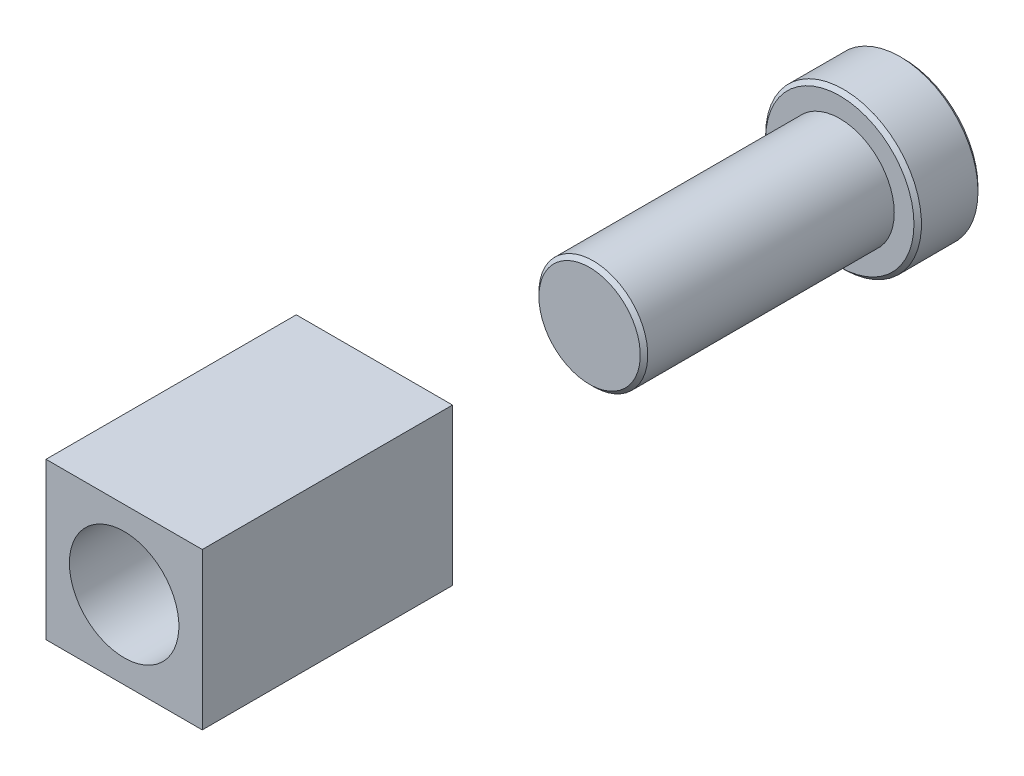
from build123d import *

# Parameters (mm, degrees)
SKETCH1_R           = 15.8115
BOSS_EXTRUDE1_DEPTH = 12.998823529
SKETCH2_R           = 11.049
BOSS_EXTRUDE2_DEPTH = 50.8
SKETCH3_W           = 31.722698392
SKETCH3_H           = 31.722698392
BOSS_EXTRUDE3_DEPTH = 50.8
SKETCH4_R           = 11.1125
CUT_EXTRUDE1_DEPTH  = 110.798996017
CHAMFER1_SIZE       = 0.762


with BuildPart() as part:
    # Sketch1 → Boss-Extrude1 (new body)
    with BuildSketch(Plane.XY):
        with Locations(Location((0, 0, 0), (0, 0, 180))):
            Circle(SKETCH1_R)
    extrude(amount=BOSS_EXTRUDE1_DEPTH)

    # Sketch2 → Boss-Extrude2 (add)
    with BuildSketch(Plane.XY.offset(12.998823529)):
        Circle(SKETCH2_R)
    extrude(amount=BOSS_EXTRUDE2_DEPTH)

    # Chamfer1
    chamfer1_edges = [part.edges().sort_by_distance(p)[0] for p in [
        (15.8115, 0, 0),
        (15.8115, 0, 12.998823529),
        (-11.049, 0, 63.798823529),
    ]]
    chamfer(chamfer1_edges, length=CHAMFER1_SIZE)


with BuildPart() as body_2:
    # Sketch3 → Boss-Extrude3 (new body)
    with BuildSketch(Plane.XY.offset(107.483276511)):
        Rectangle(SKETCH3_W, SKETCH3_H)
    extrude(amount=BOSS_EXTRUDE3_DEPTH)

    # Sketch4 → Cut-Extrude1 (cut, through all)
    with BuildSketch(Plane(origin=(0, 0, 107.483276511), x_dir=(-1, 0, 0), z_dir=(0, 0, -1))):
        Circle(SKETCH4_R)
    extrude(amount=-CUT_EXTRUDE1_DEPTH, mode=Mode.SUBTRACT)


solid = Compound([part.part, body_2.part])
